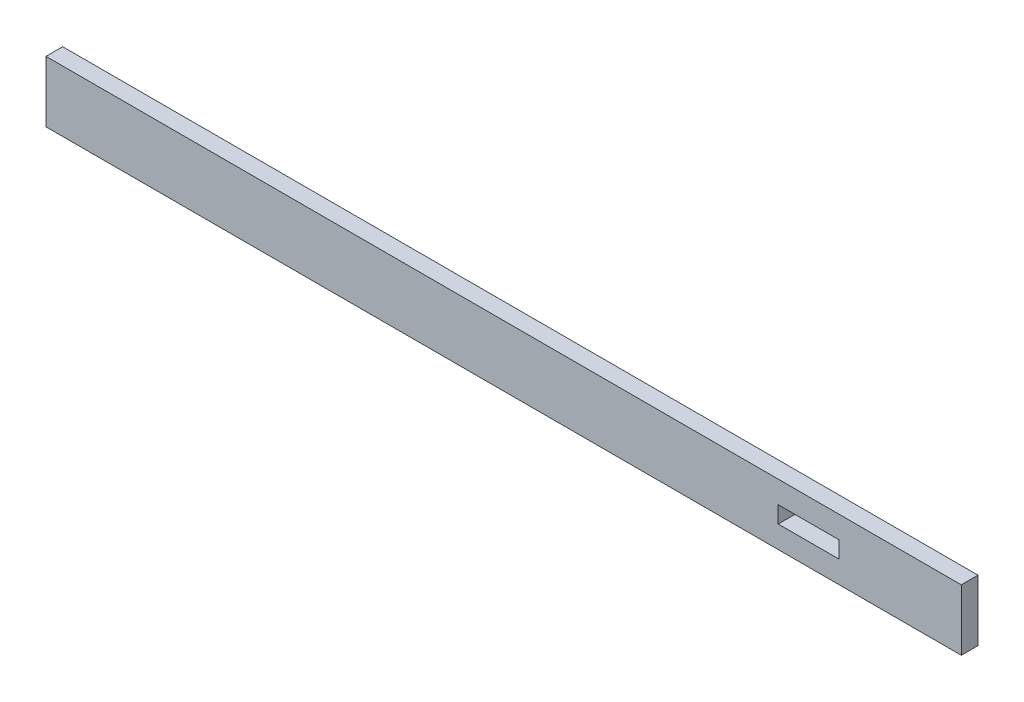
from build123d import *

# Parameters (mm, degrees)
SKETCH1_W           = 10
SKETCH1_H           = 150
SKETCH1_W_2         = 2.74
SKETCH1_H_2         = 10
BOSS_EXTRUDE1_DEPTH = 2.74


with BuildPart() as part:
    # Sketch1 → Boss-Extrude1 (new body)
    with BuildSketch(Plane(origin=(0, 0, 0), x_dir=(0, 1, 0), z_dir=(0, 0, 1))):
        with Locations((5, 75)):
            Rectangle(SKETCH1_W, SKETCH1_H)
        with Locations((5, 25)):
            Rectangle(SKETCH1_W_2, SKETCH1_H_2, mode=Mode.SUBTRACT)
    extrude(amount=BOSS_EXTRUDE1_DEPTH)


solid = part.part
